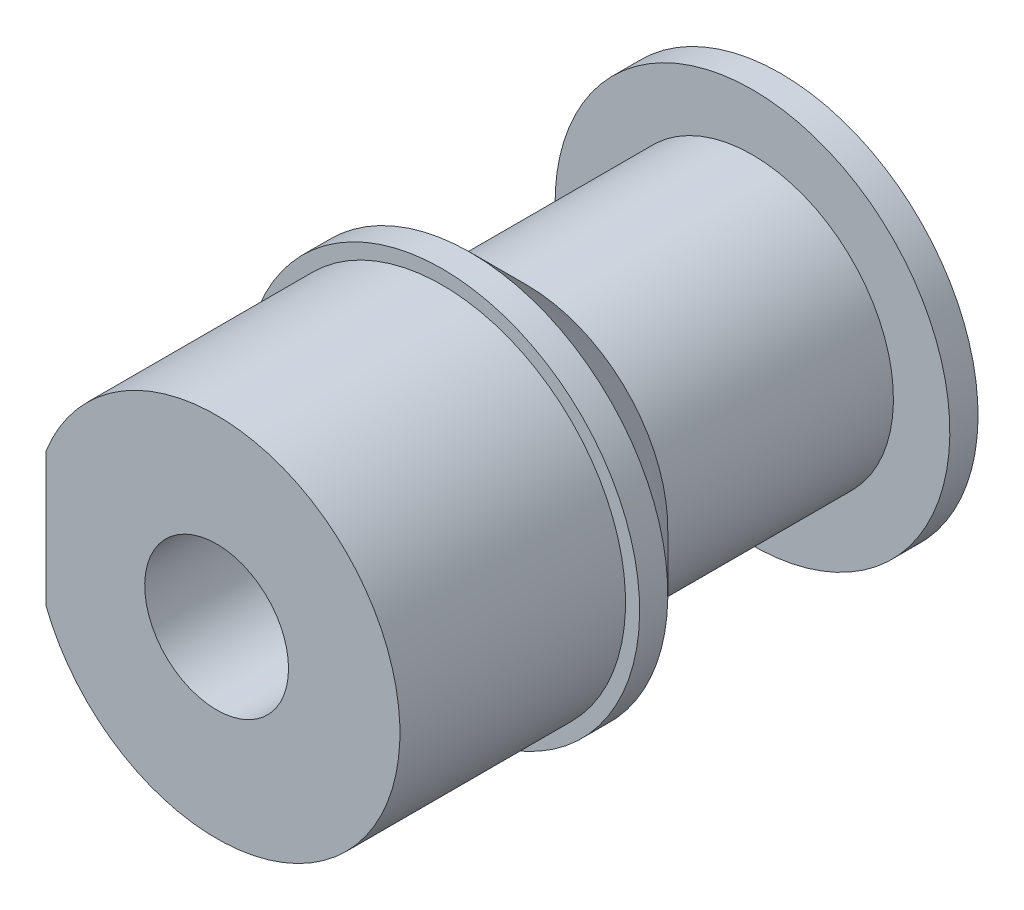
from build123d import *

# Parameters (mm, degrees)
CUT_EXTRUDE1_DEPTH      = 23.315913604
CUT_EXTRUDE1_DEPTH_BACK = 23.315913604
CUT_EXTRUDE2_START      = -8
CUT_EXTRUDE2_DEPTH      = 8
CUT_EXTRUDE3_REACH      = 26.886
SKETCH4_R               = 1.9
CUT_EXTRUDE4_START      = -5.7
SKETCH5_R               = 2.55
CUT_EXTRUDE4_DEPTH      = 5.7


with BuildPart() as part:
    # Sketch2 → Revolve1 (revolve)
    with BuildSketch(Plane(origin=(0, 0, 0), x_dir=(0, 0, -1), z_dir=(1, 0, 0))):
        Polygon((0, 0), (-20, 0), (-20, 6.5), (-12, 6.5), (-12, 7), (-11, 7), (-9, 5), (-1, 5), (-1, 7), (0, 7), align=None)
    revolve(axis=Axis((0, 0, 0), (0, 0, 1)))

    # Sketch1 → Cut-Extrude1 (cut, two sides: drawn at the far end of the back side and taken through both)
    with BuildSketch(Plane.XY.offset(-CUT_EXTRUDE1_DEPTH_BACK)):
        with BuildLine():
            Line((-2.05, 1.516575089), (-2.05, -1.516575089))
            ThreePointArc((-2.05, -1.516575089), (2.55, 0), (-2.05, 1.516575089))
        make_face()
    extrude(amount=CUT_EXTRUDE1_DEPTH + CUT_EXTRUDE1_DEPTH_BACK, mode=Mode.SUBTRACT)

    # Sketch3 → Cut-Extrude2 (cut)
    with BuildSketch(Plane.XY.offset(20).offset(CUT_EXTRUDE2_START)):
        with BuildLine():
            Line((-6.05, -2.376446928), (-6.05, 2.376446928))
            ThreePointArc((-6.05, 2.376446928), (-6.5, 0), (-6.05, -2.376446928))
        make_face()
    extrude(amount=CUT_EXTRUDE2_DEPTH, mode=Mode.SUBTRACT)

    # Sketch4 → Cut-Extrude3 (cut, up to next)
    with BuildSketch(Plane.ZY.offset(6.05), mode=Mode.PRIVATE) as cut_extrude3_sk1:
        with Locations((14.3, 0)):
            Circle(SKETCH4_R)
    cut_extrude3_tool1 = extrude(cut_extrude3_sk1.sketch, amount=-CUT_EXTRUDE3_REACH, mode=Mode.PRIVATE) & part.part
    add(cut_extrude3_tool1.solids().sort_by_distance((-6.05, 0, 14.3))[0], mode=Mode.SUBTRACT)

    # Sketch5 → Cut-Extrude4 (cut)
    with BuildSketch(Plane.XY.offset(20).offset(CUT_EXTRUDE4_START)):
        with Locations(Location((0, 0, 0), (0, 0, 143.5062334))):
            Circle(SKETCH5_R)
    extrude(amount=CUT_EXTRUDE4_DEPTH, mode=Mode.SUBTRACT)


solid = part.part
